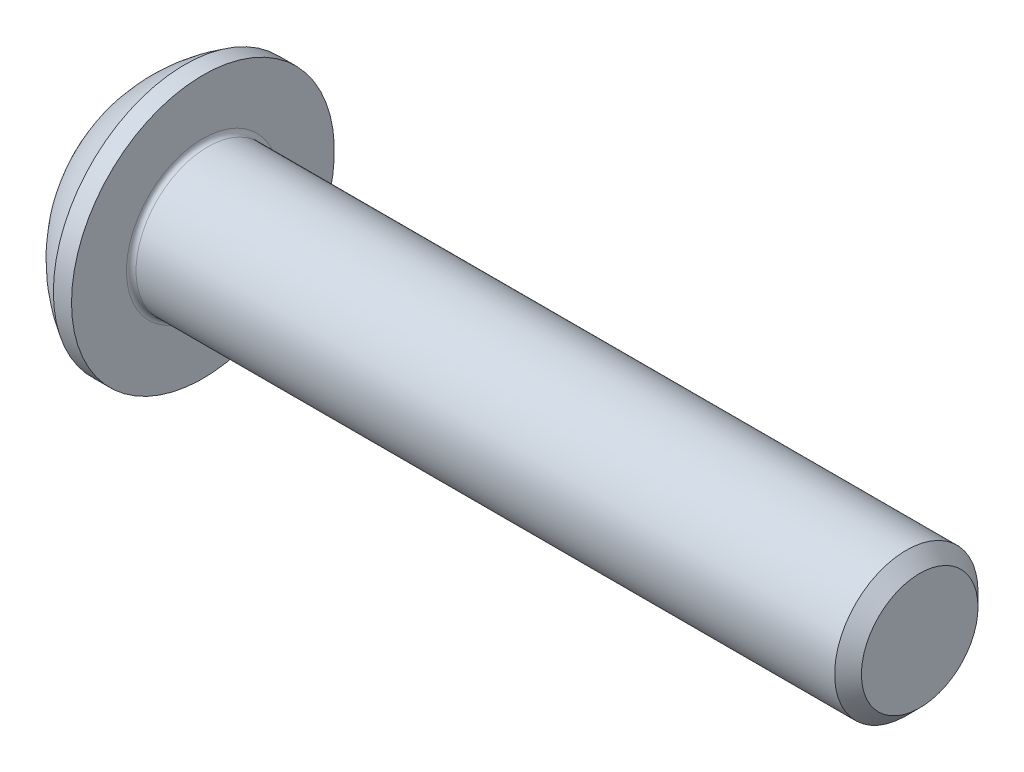
from build123d import *

# Parameters (mm, degrees)
CUT_EXTRUDE1_DEPTH        = 1.04
SKETCH4_R                 = 1.5
LARGO_Y_ANCHO_ROSCA_DEPTH = 15
FILLET1_R                 = 0.1
CHAMFER1_SIZE             = 0.2805


with BuildPart() as part:
    # Sketch1 → Revolve1 (revolve)
    with BuildSketch(Plane(origin=(0, 0, 0), x_dir=(-1, 0, 0), z_dir=(0, 0, -1)), mode=Mode.PRIVATE) as revolve1_sk:
        with BuildLine():
            Line((-1.65, 2.75), (-1.65, 0))
            Line((-1.65, 0), (0, 0))
            Line((0, 0), (0, 1.425))
            ThreePointArc((0, 1.425), (-0.542530893, 2.176130767), (-1.27, 2.75))
            Line((-1.27, 2.75), (-1.65, 2.75))
        make_face()
    revolve(revolve1_sk.sketch.rotate(Axis((1.65, 0, 0), (-1, 0, 0)), 270), axis=Axis((1.65, 0, 0), (-1, 0, 0)))

    # Sketch2 → Cut-Extrude1 (cut)
    with BuildSketch(Plane.ZY):
        Polygon((-1, 0.577350269), (-1, -0.577350269), (0, -1.154700538), (1, -0.577350269), (1, 0.577350269), (0, 1.154700538), align=None)
    extrude(amount=-CUT_EXTRUDE1_DEPTH, mode=Mode.SUBTRACT)

    # Sketch3 → Cut-Revolve1 (revolve, cut)
    with BuildSketch(Plane.XY, mode=Mode.PRIVATE) as cut_revolve1_sk:
        Polygon((1.04, 1), (1.04, 0), (1.617350269, 0), align=None)
    revolve(cut_revolve1_sk.sketch.rotate(Axis((1.04, 0, 0), (1, 0, 0)), 90), axis=Axis((1.04, 0, 0), (1, 0, 0)), mode=Mode.SUBTRACT)

    # Sketch4 → Largo y Ancho rosca (add)
    with BuildSketch(Plane(origin=(1.65, 0, 0), x_dir=(0, 0, -1), z_dir=(1, 0, 0))):
        Circle(SKETCH4_R)
    extrude(amount=LARGO_Y_ANCHO_ROSCA_DEPTH)

    # Fillet1
    fillet1_edges = [part.edges().sort_by_distance(p)[0] for p in [
        (1.65, 0, 1.5),
    ]]
    fillet(fillet1_edges, radius=FILLET1_R)

    # Chamfer1
    chamfer1_edges = [part.edges().sort_by_distance(p)[0] for p in [
        (16.65, 0, 1.5),
    ]]
    chamfer(chamfer1_edges, length=CHAMFER1_SIZE)


solid = part.part
